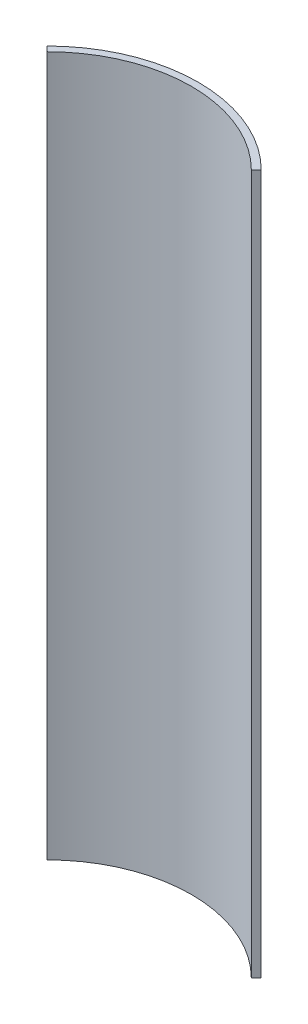
from build123d import *

# Parameters (mm, degrees)
SKETCH1_W          = 3
SKETCH1_H          = 300
SKETCH6_OUTSIDE_W  = 202.37
SKETCH6_OUTSIDE_H  = 202.37
CUT_EXTRUDE2_DEPTH = 314.767429795


with BuildPart() as part:
    # Sketch1 → Revolve1 (revolve)
    with BuildSketch(Plane.XY):
        with Locations((63.5, 0)):
            Rectangle(SKETCH1_W, SKETCH1_H)
    revolve(axis=Axis((0, 0, 0), (0, 1, 0)))

    # Sketch6 outside → Cut-Extrude2 (cut, through all)
    with BuildSketch(Plane(origin=(0, 150, 0), x_dir=(1, 0, 0), z_dir=(0, 1, 0))):
        Rectangle(SKETCH6_OUTSIDE_W, SKETCH6_OUTSIDE_H)
        with BuildLine():
            Line((0, 0), (-45.961940777, 45.961940777))
            ThreePointArc((-45.961940777, 45.961940777), (0, 65), (45.961940777, 45.961940777))
            Line((45.961940777, 45.961940777), (0, 0))
        make_face(mode=Mode.SUBTRACT)
    extrude(amount=-CUT_EXTRUDE2_DEPTH, mode=Mode.SUBTRACT)


solid = part.part
